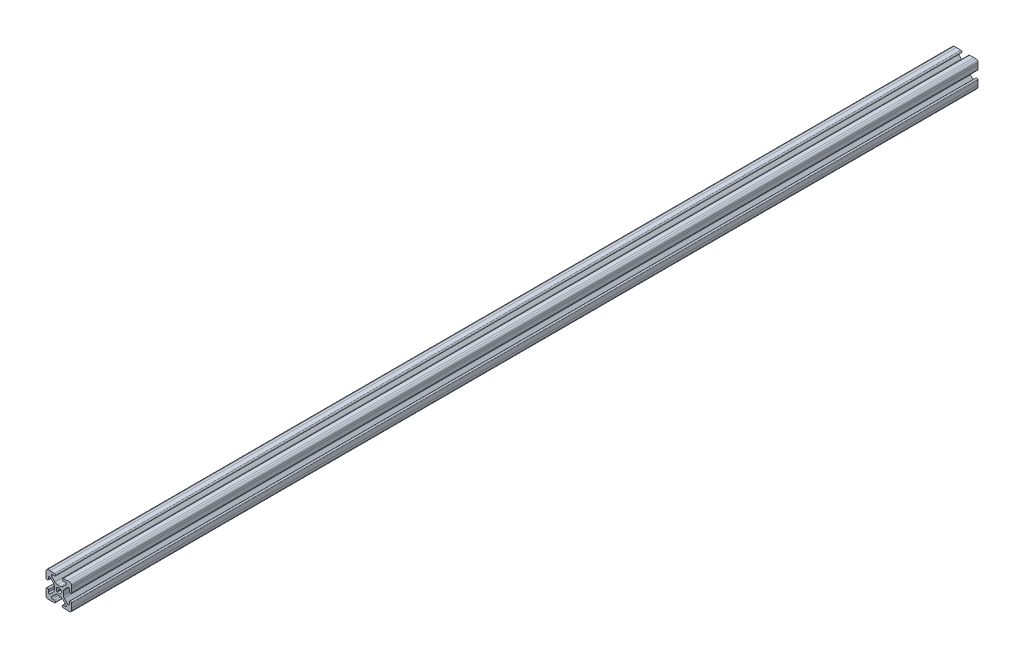
from build123d import *

# Parameters (mm, degrees)
BOSS_EXTRUDE1_DEPTH = 882.65


with BuildPart() as part:
    # Model → Boss-Extrude1 (new body)
    with BuildSketch(Plane.XY):
        with BuildLine():
            Line((50.659960212, 72.999871414), (53.774553856, 72.999871414))
            ThreePointArc((53.774553856, 72.999871414), (54.989573754, 72.758188929), (56.019617887, 72.069935444))
            Line((56.019617887, 72.069935444), (59.264200891, 68.825352439))
            ThreePointArc((59.264200891, 68.825352439), (59.477513437, 67.701802895), (58.510322513, 67.091550869))
            Line((58.510322513, 67.091550869), (56.572487817, 67.159221548))
            ThreePointArc((56.572487817, 67.159221548), (55.4691069, 66.130302197), (56.498026251, 65.026921279))
            Line((56.498026251, 65.026921279), (60.677257034, 64.880979325))
            Line((60.677257034, 64.880979325), (62.710657034, 64.880979325))
            ThreePointArc((62.710657034, 64.880979325), (64.129537501, 65.468698857), (64.717257034, 66.887579325))
            Line((64.717257034, 66.887579325), (64.717257034, 68.920979325))
            Line((64.717257034, 68.920979325), (64.57131508, 73.100210108))
            ThreePointArc((64.57131508, 73.100210108), (63.467934162, 74.129129459), (62.439014811, 73.025748542))
            Line((62.439014811, 73.025748542), (62.50668549, 71.087913846))
            ThreePointArc((62.50668549, 71.087913846), (61.896433464, 70.120722922), (60.77288392, 70.334035468))
            Line((60.77288392, 70.334035468), (57.528300915, 73.578618472))
            ThreePointArc((57.528300915, 73.578618472), (56.84004743, 74.608662605), (56.598364945, 75.823682503))
            Line((56.598364945, 75.823682503), (56.598364945, 78.938276147))
            ThreePointArc((56.598364945, 78.938276147), (56.84004743, 80.153296044), (57.528300915, 81.183340177))
            Line((57.528300915, 81.183340177), (60.77288392, 84.427923182))
            ThreePointArc((60.77288392, 84.427923182), (61.896433464, 84.641235728), (62.50668549, 83.674044803))
            Line((62.50668549, 83.674044803), (62.439014811, 81.736210108))
            ThreePointArc((62.439014811, 81.736210108), (63.467934162, 80.63282919), (64.57131508, 81.661748542))
            Line((64.57131508, 81.661748542), (64.717257034, 85.840979325))
            Line((64.717257034, 85.840979325), (64.717257034, 87.874379325))
            ThreePointArc((64.717257034, 87.874379325), (64.129537501, 89.293259792), (62.710657034, 89.880979325))
            Line((62.710657034, 89.880979325), (60.677257034, 89.880979325))
            Line((60.677257034, 89.880979325), (56.498026251, 89.73503737))
            ThreePointArc((56.498026251, 89.73503737), (55.4691069, 88.631656452), (56.572487817, 87.602737101))
            Line((56.572487817, 87.602737101), (58.510322513, 87.67040778))
            ThreePointArc((58.510322513, 87.67040778), (59.477513437, 87.060155754), (59.264200891, 85.93660621))
            Line((59.264200891, 85.93660621), (56.019617887, 82.692023205))
            ThreePointArc((56.019617887, 82.692023205), (54.989573754, 82.00376972), (53.774553856, 81.762087236))
            Line((53.774553856, 81.762087236), (50.659960212, 81.762087236))
            ThreePointArc((50.659960212, 81.762087236), (49.444940315, 82.00376972), (48.414896182, 82.692023205))
            Line((48.414896182, 82.692023205), (45.170313177, 85.93660621))
            ThreePointArc((45.170313177, 85.93660621), (44.957000631, 87.060155754), (45.924191556, 87.67040778))
            Line((45.924191556, 87.67040778), (47.862026251, 87.602737101))
            ThreePointArc((47.862026251, 87.602737101), (48.965407169, 88.631656452), (47.936487817, 89.73503737))
            Line((47.936487817, 89.73503737), (43.757257034, 89.880979325))
            Line((43.757257034, 89.880979325), (41.723857034, 89.880979325))
            ThreePointArc((41.723857034, 89.880979325), (40.304976567, 89.293259792), (39.717257034, 87.874379325))
            Line((39.717257034, 87.874379325), (39.717257034, 85.840979325))
            Line((39.717257034, 85.840979325), (39.863198989, 81.661748542))
            ThreePointArc((39.863198989, 81.661748542), (40.966579907, 80.63282919), (41.995499258, 81.736210108))
            Line((41.995499258, 81.736210108), (41.927828579, 83.674044803))
            ThreePointArc((41.927828579, 83.674044803), (42.538080605, 84.641235728), (43.661630149, 84.427923182))
            Line((43.661630149, 84.427923182), (46.906213154, 81.183340177))
            ThreePointArc((46.906213154, 81.183340177), (47.594466639, 80.153296044), (47.836149123, 78.938276147))
            Line((47.836149123, 78.938276147), (47.836149123, 75.823682503))
            ThreePointArc((47.836149123, 75.823682503), (47.594466639, 74.608662605), (46.906213154, 73.578618472))
            Line((46.906213154, 73.578618472), (43.661630149, 70.334035468))
            ThreePointArc((43.661630149, 70.334035468), (42.538080605, 70.120722922), (41.927828579, 71.087913846))
            Line((41.927828579, 71.087913846), (41.995499258, 73.025748542))
            ThreePointArc((41.995499258, 73.025748542), (40.966579907, 74.129129459), (39.863198989, 73.100210108))
            Line((39.863198989, 73.100210108), (39.717257034, 68.920979325))
            Line((39.717257034, 68.920979325), (39.717257034, 66.887579325))
            ThreePointArc((39.717257034, 66.887579325), (40.304976567, 65.468698857), (41.723857034, 64.880979325))
            Line((41.723857034, 64.880979325), (43.757257034, 64.880979325))
            Line((43.757257034, 64.880979325), (47.936487817, 65.026921279))
            ThreePointArc((47.936487817, 65.026921279), (48.965407169, 66.130302197), (47.862026251, 67.159221548))
            Line((47.862026251, 67.159221548), (45.924191556, 67.091550869))
            ThreePointArc((45.924191556, 67.091550869), (44.957000631, 67.701802895), (45.170313177, 68.825352439))
            Line((45.170313177, 68.825352439), (48.414896182, 72.069935444))
            ThreePointArc((48.414896182, 72.069935444), (49.444940315, 72.758188929), (50.659960212, 72.999871414))
        make_face()
        with BuildLine():
            Line((50.64953831, 75.433607249), (50.269884959, 75.433607249))
            Line((50.269884959, 75.433607249), (50.269884959, 75.8132606))
            ThreePointArc((50.269884959, 75.8132606), (53.985023987, 79.148746278), (50.64953831, 75.433607249))
        make_face(mode=Mode.SUBTRACT)
    extrude(amount=BOSS_EXTRUDE1_DEPTH)


solid = part.part
